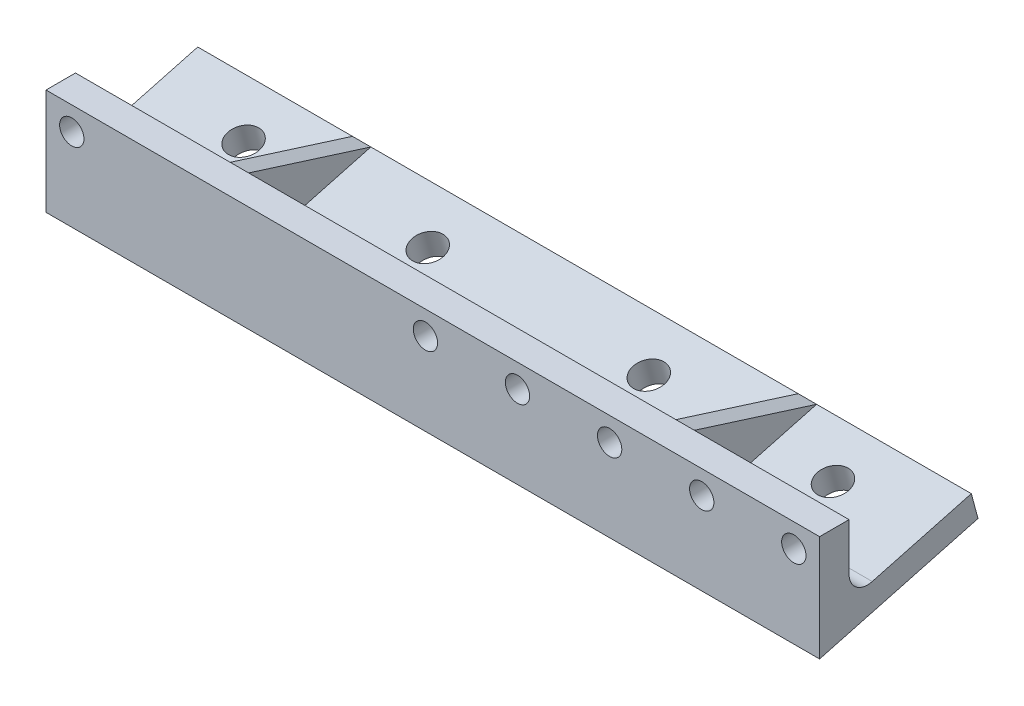
from build123d import *

# Parameters (mm, degrees)
EXTRUDE_1_DEPTH      = 30
SKETCH_2_R           = 44.45
CUT_EXTRUDE_1_DEPTH  = 4
SKETCH_3_R           = 25.5
SKETCH_3_R_2         = 2.25
CUT_EXTRUDE_2_DEPTH  = 188.619295383
CUT_EXTRUDE_3_DEPTH  = 189.215302247
SKETCH_5_R           = 1.65
CUT_EXTRUDE_4_DEPTH  = 189.215302247
EXTRUDE_START        = -30
EXTRUDE_2_DEPTH      = 30
CUT_EXTRUDE_5_DEPTH  = 198.040604952
CUT_EXTRUDE_7_DEPTH  = 233.432785983
CUT_EXTRUDE_8_DEPTH  = 233.432785983
CUT_EXTRUDE_9_DEPTH  = 233.432785983
FILLET_1_R           = 5
CUT_EXTRUDE_10_DEPTH = 233.432785983
EXTRUDE_START_2      = -5
EXTRUDE_3_DEPTH      = 5
EXTRUDE_4_DEPTH      = 5
SKETCH_14_R          = 4.25
CUT_EXTRUDE_11_DEPTH = 189.364728478
SKETCH_16_W          = 43
SKETCH_16_H          = 30
CUT_EXTRUDE_12_DEPTH = 233.432785983
EXTRUDE_7_REACH      = 188.592
SKETCH_18_W          = 210
SKETCH_18_H          = 5
EXTRUDE_8_DEPTH      = 210
EXTRUDE_9_DEPTH      = 5
EXTRUDE_10_DEPTH     = 5
SKETCH_22_R          = 4.25
CUT_EXTRUDE_13_DEPTH = 187.984035343
FILLET_2_R           = 5
CUT_EXTRUDE_14_DEPTH = 234.418610938
EXTRUDE_11_DEPTH     = 2.5
CUT_EXTRUDE_START    = -5
CUT_EXTRUDE_16_DEPTH = 5
SKETCH_24_R          = 3.3
CUT_EXTRUDE_17_DEPTH = 165.58736282
EXTRUDE_12_DEPTH     = 2.5
CUT_EXTRUDE_18_DEPTH = 5


with BuildPart() as part:
    # 草图1 → 凸台-拉伸1 (new body)
    with BuildSketch(Plane(origin=(0, 0, 0), x_dir=(1, 0, 0), z_dir=(0, 1, 0))):
        with BuildLine():
            Line((170, 31.93), (170, -31.93))
            ThreePointArc((170, -31.93), (167.781993847, -38.210172909), (162.111885646, -41.704453387))
            Line((162.111885646, -41.704453387), (15.839142344, -73.308400404))
            ThreePointArc((15.839142344, -73.308400404), (-75, 0), (15.839142344, 73.308400404))
            Line((15.839142344, 73.308400404), (162.111885646, 41.704453387))
            ThreePointArc((162.111885646, 41.704453387), (167.781993847, 38.210172909), (170, 31.93))
        make_face()
    extrude(amount=EXTRUDE_1_DEPTH)

    # 草图2 → 切除-拉伸1 (cut)
    with BuildSketch(Plane(origin=(0, 30, 0), x_dir=(1, 0, 0), z_dir=(0, 1, 0))):
        with Locations(Location((0, 0, 0), (0, 0, 270))):
            Circle(SKETCH_2_R)
    extrude(amount=-CUT_EXTRUDE_1_DEPTH, mode=Mode.SUBTRACT)

    # 草图3 → 切除-拉伸2 (cut, through all)
    with BuildSketch(Plane(origin=(0, 26, 0), x_dir=(1, 0, 0), z_dir=(0, 1, 0))):
        with Locations(Location((0, 0, 0), (0, 0, 270))):
            Circle(SKETCH_3_R)
        with Locations(Location((0, 41, 0), (0, 0, 270))):
            Circle(SKETCH_3_R_2)
        with Locations(Location((28.991378029, 28.991378029, 0), (0, 0, 270))):
            Circle(SKETCH_3_R_2)
        with Locations(Location((41, 0, 0), (0, 0, 270))):
            Circle(SKETCH_3_R_2)
        with Locations(Location((28.991378029, -28.991378029, 0), (0, 0, 270))):
            Circle(SKETCH_3_R_2)
        with Locations(Location((0, -41, 0), (0, 0, 270))):
            Circle(SKETCH_3_R_2)
        with Locations(Location((-28.991378029, -28.991378029, 0), (0, 0, 270))):
            Circle(SKETCH_3_R_2)
        with Locations(Location((-41, 0, 0), (0, 0, 270))):
            Circle(SKETCH_3_R_2)
        with Locations(Location((-28.991378029, 28.991378029, 0), (0, 0, 270))):
            Circle(SKETCH_3_R_2)
    extrude(amount=-CUT_EXTRUDE_2_DEPTH, mode=Mode.SUBTRACT)

    # 草图4 → 切除-拉伸3 (cut, through all)
    with BuildSketch(Plane(origin=(0, 30, 0), x_dir=(1, 0, 0), z_dir=(0, 1, 0))):
        with BuildLine():
            Line((124, 18.5), (134, 18.5))
            ThreePointArc((134, 18.5), (152.5, 0), (134, -18.5))
            Line((134, -18.5), (124, -18.5))
            ThreePointArc((124, -18.5), (105.5, 0), (124, 18.5))
        make_face()
    extrude(amount=-CUT_EXTRUDE_3_DEPTH, mode=Mode.SUBTRACT)

    # 草图5 → 切除-拉伸4 (cut, through all)
    with BuildSketch(Plane(origin=(0, 30, 0), x_dir=(1, 0, 0), z_dir=(0, 1, 0))):
        with Locations(Location((116.75, 25.5, 0), (0, 0, 270))):
            Circle(SKETCH_5_R)
        with Locations(Location((141.25, 25.5, 0), (0, 0, 270))):
            Circle(SKETCH_5_R)
        with Locations(Location((141.25, -25.5, 0), (0, 0, 270))):
            Circle(SKETCH_5_R)
        with Locations(Location((116.75, -25.5, 0), (0, 0, 270))):
            Circle(SKETCH_5_R)
    extrude(amount=-CUT_EXTRUDE_4_DEPTH, mode=Mode.SUBTRACT)

    # 草图6 → 凸台-拉伸2 (add)
    with BuildSketch(Plane(origin=(0, 30, 0), x_dir=(1, 0, 0), z_dir=(0, 1, 0)).offset(EXTRUDE_START)):
        with BuildLine():
            Line((158, 95), (-52, 95))
            Line((-52, 95), (-52, 54.046276467))
            ThreePointArc((-52, 54.046276467), (-20.48558667, 72.148047366), (15.839142344, 73.308400404))
            Line((15.839142344, 73.308400404), (158, 42.592874655))
            Line((158, 42.592874655), (158, 95))
        make_face()
        with BuildLine():
            ThreePointArc((15.839142344, -73.308400404), (-20.48558667, -72.148047366), (-52, -54.046276467))
            Line((-52, -54.046276467), (-52, -95))
            Line((-52, -95), (158, -95))
            Line((158, -95), (158, -42.592874655))
            Line((158, -42.592874655), (15.839142344, -73.308400404))
        make_face()
    extrude(amount=EXTRUDE_2_DEPTH)

    # 草图7 → 切除-拉伸5 (cut, through all)
    with BuildSketch(Plane(origin=(0, 30, 0), x_dir=(1, 0, 0), z_dir=(0, 1, 0))):
        with BuildLine():
            Line((-52, 54.046276467), (-52, -54.046276467))
            ThreePointArc((-52, -54.046276467), (-75, 0), (-52, 54.046276467))
        make_face()
        with BuildLine():
            Line((158, 42.592874655), (158, -42.592874655))
            Line((158, -42.592874655), (162.111885646, -41.704453387))
            ThreePointArc((162.111885646, -41.704453387), (167.781993847, -38.210172909), (170, -31.93))
            Line((170, -31.93), (170, 31.93))
            ThreePointArc((170, 31.93), (167.781993847, 38.210172909), (162.111885646, 41.704453387))
            Line((162.111885646, 41.704453387), (158, 42.592874655))
        make_face()
    extrude(amount=-CUT_EXTRUDE_5_DEPTH, mode=Mode.SUBTRACT)

    # 草图9 → 切除-拉伸7 (cut, through all)
    with BuildSketch(Plane.ZY.offset(52)):
        Polygon((-95, 20), (-60, 10.621778265), (-60, 30), (-95, 30), align=None)
    extrude(amount=-CUT_EXTRUDE_7_DEPTH, mode=Mode.SUBTRACT)

    # 草图10 → 切除-拉伸8 (cut, through all)
    with BuildSketch(Plane.ZY.offset(52)):
        Polygon((-95, 12.753066737), (-52, 1.231251463), (-52, 0), (-95, 0), align=None)
    extrude(amount=-CUT_EXTRUDE_8_DEPTH, mode=Mode.SUBTRACT)

    # 草图8 → 切除-拉伸9 (cut, through all)
    with BuildSketch(Plane.ZY.offset(52)):
        Polygon((0, 0), (52, 0), (52, 17.3), (-52, 17.3), (-52, 0), align=None)
    extrude(amount=-CUT_EXTRUDE_9_DEPTH, mode=Mode.SUBTRACT)

    # 圆角1
    fillet_1_edges = [part.edges().sort_by_distance(p)[0] for p in [
        (53, 10.621778265, -60),
    ]]
    fillet(fillet_1_edges, radius=FILLET_1_R)

    # 草图11 → 切除-拉伸10 (cut, through all)
    with BuildSketch(Plane.ZY.offset(52)):
        Polygon((-95, 12.753066737), (-93.188266684, 19.514547521), (-95, 20), align=None)
    extrude(amount=-CUT_EXTRUDE_10_DEPTH, mode=Mode.SUBTRACT)

    # 草图12 → 凸台-拉伸3 (add)
    with BuildSketch(Plane.ZY.offset(52).offset(EXTRUDE_START_2)):
        with BuildLine():
            Line((-93.188266684, 19.514547521), (-60, 30))
            Line((-60, 30), (-60, 17.137905129))
            ThreePointArc((-60, 17.137905129), (-61.956192855, 13.171138428), (-66.294095226, 12.308275998))
            Line((-66.294095226, 12.308275998), (-93.188266684, 19.514547521))
        make_face()
    extrude(amount=EXTRUDE_3_DEPTH)

    # 草图13 → 凸台-拉伸4 (add)
    with BuildSketch(Plane(origin=(158, 0, 0), x_dir=(0, 0, -1), z_dir=(1, 0, 0))):
        with BuildLine():
            Line((66.294095226, 12.308275998), (93.188266684, 19.514547521))
            Line((93.188266684, 19.514547521), (60, 30))
            Line((60, 30), (60, 17.137905129))
            ThreePointArc((60, 17.137905129), (61.956192855, 13.171138428), (66.294095226, 12.308275998))
        make_face()
    extrude(amount=-EXTRUDE_4_DEPTH)

    # 草图14 → 切除-拉伸11 (cut, through all)
    with BuildSketch(Plane(origin=(0, -5.089745962, -1.36379332), x_dir=(1, 0, 0), z_dir=(0, 0.9659258262890681, 0.2588190451025214))):
        with Locations(Location((-27, 82.063690052, 0), (0, 0, 270))):
            Circle(SKETCH_14_R)
        with Locations(Location((23, 82.063690052, 0), (0, 0, 270))):
            Circle(SKETCH_14_R)
        with Locations(Location((83, 82.063690052, 0), (0, 0, 270))):
            Circle(SKETCH_14_R)
        with Locations(Location((133, 82.063690052, 0), (0, 0, 270))):
            Circle(SKETCH_14_R)
    extrude(amount=-CUT_EXTRUDE_11_DEPTH, mode=Mode.SUBTRACT)

    # 草图16 → 切除-拉伸12 (cut, through all)
    with BuildSketch(Plane.ZY.offset(52)):
        with Locations((73.5, 15)):
            Rectangle(SKETCH_16_W, SKETCH_16_H)
    extrude(amount=-CUT_EXTRUDE_12_DEPTH, mode=Mode.SUBTRACT)

    # 凸台-拉伸7: up to this plane
    extrude_7_end = Plane(origin=(0, -11.851226746, -3.175526636), z_dir=(0, -0.9659258262890681, -0.25881904510252146))
    # 草图18 → 凸台-拉伸7 (add, up to the surface)
    with BuildSketch(Plane(origin=(0, 30, 0), x_dir=(1, 0, 0), z_dir=(0, 1, 0)), mode=Mode.PRIVATE) as extrude_7_sk1:
        with Locations((53, -54.5)):
            Rectangle(SKETCH_18_W, SKETCH_18_H)
    extrude_7_tool1 = split(extrude(extrude_7_sk1.sketch, amount=-EXTRUDE_7_REACH, mode=Mode.PRIVATE), bisect_by=extrude_7_end, keep=Keep.BOTH, mode=Mode.PRIVATE)
    add(extrude_7_tool1.solids().sort_by_distance((53, 30, 54.5))[0])

    # 草图19 → 凸台-拉伸8 (add)
    with BuildSketch(Plane.ZY.offset(52)):
        Polygon((57, -27.975210512), (90.188266684, -36.867979769), (92, -30.106498985), (57, -20.72827725), align=None)
    extrude(amount=-EXTRUDE_8_DEPTH)

    # 草图20 → 凸台-拉伸9 (add)
    with BuildSketch(Plane.ZY.offset(52)):
        Polygon((92, -30.106498985), (57, -20.72827725), (57, 30), align=None)
    extrude(amount=-EXTRUDE_9_DEPTH)

    # 草图21 → 凸台-拉伸10 (add)
    with BuildSketch(Plane(origin=(158, 0, 0), x_dir=(0, 0, -1), z_dir=(1, 0, 0))):
        Polygon((-57, 30), (-92, -30.106498985), (-57, -20.72827725), align=None)
    extrude(amount=-EXTRUDE_10_DEPTH)

    # 草图22 → 切除-拉伸13 (cut, through all)
    with BuildSketch(Plane(origin=(0, -5.089745962, -1.36379332), x_dir=(1, 0, 0), z_dir=(0, 0.9659258262890686, 0.25881904510251946))):
        with Locations(Location((-27, -77.936309948, 0), (0, 0, 270))):
            Circle(SKETCH_22_R)
        with Locations(Location((23, -69.936309948, 0), (0, 0, 270))):
            Circle(SKETCH_22_R)
        with Locations(Location((83, -69.936309948, 0), (0, 0, 270))):
            Circle(SKETCH_22_R)
        with Locations(Location((133, -77.936309948, 0), (0, 0, 270))):
            Circle(SKETCH_22_R)
    extrude(amount=-CUT_EXTRUDE_13_DEPTH, mode=Mode.SUBTRACT)

    # 圆角2
    fillet_2_edges = [part.edges().sort_by_distance(p)[0] for p in [
        (53, -20.72827725, 57),
    ]]
    fillet(fillet_2_edges, radius=FILLET_2_R)

    # 草图23 → 切除-拉伸14 (cut, through all)
    with BuildSketch(Plane.ZY.offset(52)):
        Polygon((-52, 17.3), (-52, 40.52409207), (98.672945053, 40.52409207), (98.672945053, -43.91232927), (-52, -43.91232927), align=None)
    extrude(amount=-CUT_EXTRUDE_14_DEPTH, mode=Mode.SUBTRACT)

    # 草图27 → 凸台-拉伸11 (add, symmetric)
    with BuildSketch(Plane(origin=(113.5, 0, 0), x_dir=(0, 0, -1), z_dir=(1, 0, 0))):
        with BuildLine():
            Line((60, 30), (60, 17.137905129))
            ThreePointArc((60, 17.137905129), (61.956192855, 13.171138428), (66.294095226, 12.308275998))
            Line((66.294095226, 12.308275998), (93.188266684, 19.514547521))
            Line((93.188266684, 19.514547521), (60, 30))
        make_face()
    extrude(amount=EXTRUDE_11_DEPTH, both=True)

    # 草图29 → 切除-拉伸16 (cut)
    with BuildSketch(Plane.ZY.offset(-153).offset(CUT_EXTRUDE_START)):
        with BuildLine():
            Line((-60, 17.137905129), (-60, 30))
            Line((-60, 30), (-93.188266684, 19.514547521))
            Line((-93.188266684, 19.514547521), (-66.294095226, 12.308275998))
            ThreePointArc((-66.294095226, 12.308275998), (-61.956192855, 13.171138428), (-60, 17.137905129))
        make_face()
    extrude(amount=CUT_EXTRUDE_16_DEPTH, mode=Mode.SUBTRACT)

    # 草图24 → 切除-拉伸17 (cut, through all)
    with BuildSketch(Plane(origin=(0, 0, -60), x_dir=(-1, 0, 0), z_dir=(0, 0, -1))):
        with Locations((45, 23.65)):
            Circle(SKETCH_24_R)
        with Locations((-151, 23.65)):
            Circle(SKETCH_24_R)
        with Locations((-126, 23.65)):
            Circle(SKETCH_24_R)
        with Locations((-101, 23.65)):
            Circle(SKETCH_24_R)
        with Locations((-76, 23.65)):
            Circle(SKETCH_24_R)
        with Locations((-51, 23.65)):
            Circle(SKETCH_24_R)
    extrude(amount=-CUT_EXTRUDE_17_DEPTH, mode=Mode.SUBTRACT)

    # 草图30 → 凸台-拉伸12 (add, symmetric)
    with BuildSketch(Plane.ZY.offset(7.5)):
        with BuildLine():
            Line((-93.188266684, 19.514547521), (-66.294095226, 12.308275998))
            ThreePointArc((-66.294095226, 12.308275998), (-61.956192855, 13.171138428), (-60, 17.137905129))
            Line((-60, 17.137905129), (-60, 21.02511905))
            Line((-60, 21.02511905), (-60, 26.27488095))
            Line((-60, 26.27488095), (-60, 30))
            Line((-60, 30), (-93.188266684, 19.514547521))
        make_face()
    extrude(amount=EXTRUDE_12_DEPTH, both=True)

    # 草图31 → 切除-拉伸18 (cut)
    with BuildSketch(Plane(origin=(-47, 0, 0), x_dir=(0, 0, -1), z_dir=(1, 0, 0))):
        with BuildLine():
            Line((66.294095226, 12.308275998), (93.188266684, 19.514547521))
            Line((93.188266684, 19.514547521), (60, 30))
            Line((60, 30), (60, 26.27488095))
            Line((60, 26.27488095), (60, 21.02511905))
            Line((60, 21.02511905), (60, 17.137905129))
            ThreePointArc((60, 17.137905129), (61.956192855, 13.171138428), (66.294095226, 12.308275998))
        make_face()
    extrude(amount=-CUT_EXTRUDE_18_DEPTH, mode=Mode.SUBTRACT)


solid = part.part
